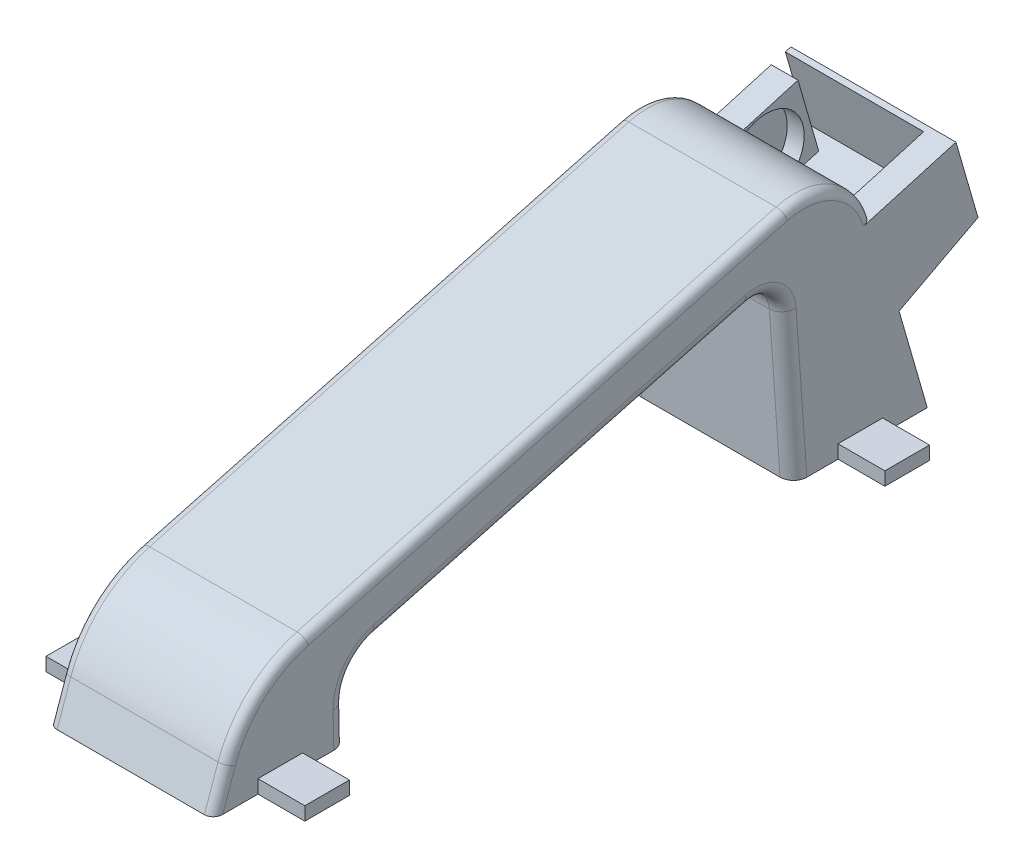
from build123d import *

# Parameters (mm, degrees)
BOSS_EXTRUDE2_DEPTH  = 18.5
SKETCH6_W            = 6
SKETCH6_H            = 24
BOSS_EXTRUDE3_DEPTH  = 15
SKETCH8_R            = 8.5
CUT_EXTRUDE1_DEPTH   = 3.8
FILLET1_R            = 2
CUT_EXTRUDE2_DEPTH   = 5.75
SKETCH13_R           = 1.5
BOSS_EXTRUDE4_DEPTH  = 2.8
CUT_EXTRUDE3_DEPTH   = 5
BOSS_EXTRUDE5_DEPTH  = 25
BOSS_EXTRUDE6_DEPTH  = 6
BOSS_EXTRUDE7_DEPTH  = 6
SKETCH21_W           = 10
SKETCH21_H           = 3
BOSS_EXTRUDE8_DEPTH  = 29
CUT_EXTRUDE4_DEPTH   = 40.35
FILLET3_R            = 3
BOSS_EXTRUDE9_DEPTH  = 0.72
BOSS_EXTRUDE10_DEPTH = 0.5


with BuildPart() as part:
    # Sketch3 → Boss-Extrude2 (new, symmetric)
    with BuildSketch(Plane(origin=(0, 0, 0), x_dir=(0, 0, -1), z_dir=(1, 0, 0))):
        with BuildLine():
            Line((70.215644723, -14.616921021), (-37.149843007, -43.385416754))
            ThreePointArc((-37.149843007, -43.385416754), (-48.03185115, -49.400738918), (-54.840494563, -59.804804318))
            Line((-54.840494563, -59.804804318), (-57.890133894, -68.528435815))
            Line((-57.890133894, -68.528435815), (-27.890133894, -68.528435815))
            Line((-27.890133894, -68.528435815), (-28.045315276, -60.640833764))
            ThreePointArc((-28.045315276, -60.640833764), (-26.192831463, -54.90703393), (-21.199231295, -51.534777392))
            Line((-21.199231295, -51.534777392), (62.07239701, -29.222211835))
            ThreePointArc((62.07239701, -29.222211835), (67.179013313, -30.144661991), (69.717111946, -34.670863455))
            Line((69.717111946, -34.670863455), (72.109866106, -68.528435815))
            Line((72.109866106, -68.528435815), (102.109866106, -68.528435815))
            Line((102.109866106, -68.528435815), (89.729215008, -25.63469666))
            ThreePointArc((89.729215008, -25.63469666), (82.223369532, -16.13917208), (70.215644723, -14.616921021))
        make_face()
    extrude(amount=BOSS_EXTRUDE2_DEPTH, both=True)

    # Sketch6 → Boss-Extrude3 (add)
    with BuildSketch(Plane(origin=(0, 21.935901884, -75.99865678), x_dir=(-1, 0, 0), z_dir=(0, 0.2773148488694124, -0.9607790977100487))):
        with Locations((15.5, -61.512524426)):
            Rectangle(SKETCH6_W, SKETCH6_H)
        with Locations((-15.5, -61.512524426)):
            Rectangle(SKETCH6_W, SKETCH6_H)
    extrude(amount=BOSS_EXTRUDE3_DEPTH)

    # Sketch8 → Cut-Extrude1 (cut, symmetric)
    with BuildSketch(Plane(origin=(-12.5, 0, 0), x_dir=(0, 0, -1), z_dir=(1, 0, 0))):
        with Locations(Location((97.028944136, -32.895134295, 0), (0, 0, 90))):
            Circle(SKETCH8_R)
    extrude(amount=CUT_EXTRUDE1_DEPTH, both=True, mode=Mode.SUBTRACT)

    # Fillet1
    fillet1_edges = [part.edges().sort_by_distance(p)[0] for p in [
        (-18.5, -64.166620067, 56.365314228),
        (-18.5, -49.400738918, 48.03185115),
        (-18.5, -29.001168888, -16.532900858),
        (-18.5, -16.13917208, -82.223369532),
        (18.5, -16.13917208, -82.223369532),
        (18.5, -29.001168888, -16.532900858),
        (18.5, -49.400738918, 48.03185115),
        (18.5, -64.166620067, 56.365314228),
    ]]
    fillet(fillet1_edges, radius=FILLET1_R)

    # Sketch11 → Cut-Extrude2 (cut, symmetric)
    with BuildSketch(Plane(origin=(0, -56.217610423, -16.226391868), x_dir=(-1, 0, 0), z_dir=(0, -0.9607790977100485, -0.27731484886941254))):
        Polygon((7.81656328, 78.53918235), (7.81656328, 78.58046301), (6.681356159, 78.58046301), (6.681356159, 79.101072204), (8.7, 79.101072204), (8.7, 78.53918235), align=None)
    extrude(amount=CUT_EXTRUDE2_DEPTH, both=True, mode=Mode.SUBTRACT)

    # Sketch13 → Boss-Extrude4 (add)
    with BuildSketch(Plane.ZY.offset(-12.5)):
        with Locations(Location((-97.028944136, -32.895134295, 0), (0, 0, 90))):
            Circle(SKETCH13_R)
    extrude(amount=BOSS_EXTRUDE4_DEPTH)

    # Sketch14 → Cut-Extrude3 (cut, symmetric)
    with BuildSketch(Plane(origin=(0, -56.217610423, -16.226391868), x_dir=(-1, 0, 0), z_dir=(0, -0.9607790977100485, -0.27731484886941254))):
        Polygon((5.308970226, 79.101072204), (5.308970226, 77.251148467), (4.283134363, 78.247993316), (-8.727974615, 78.247993316), (-9.605863403, 79.101072204), align=None)
    extrude(amount=CUT_EXTRUDE3_DEPTH, both=True, mode=Mode.SUBTRACT)

    # Sketch15 → Boss-Extrude5 (add)
    with BuildSketch(Plane(origin=(-12.5, 0, 0), x_dir=(0, 0, -1), z_dir=(1, 0, 0))):
        with BuildLine():
            Line((111.949490243, -36.654906984), (102.97963174, -39.243925585))
            ThreePointArc((102.97963174, -39.243925585), (99.232939792, -41.312986571), (94.953026489, -41.345483383))
            Line((94.953026489, -41.345483383), (94.312323076, -41.513234906))
            Line((94.312323076, -41.513234906), (95.789450175, -46.63085788))
            Line((95.789450175, -46.63085788), (113.479734367, -37.311821168))
            Line((113.479734367, -37.311821168), (108.542002376, -20.204660455))
            Line((108.542002376, -20.204660455), (107.304466525, -20.561857097))
            Line((107.304466525, -20.561857097), (111.949490243, -36.654906984))
        make_face()
    extrude(amount=BOSS_EXTRUDE5_DEPTH)

    # Sketch16 → Boss-Extrude6 (add)
    with BuildSketch(Plane(origin=(-12.5, 0, 0), x_dir=(0, 0, -1), z_dir=(1, 0, 0))):
        Polygon((108.785925192, -37.568023814), (109.341234091, -39.491935155), (113.479734367, -37.311821168), (108.542002376, -20.204660455), (107.304466525, -20.561857097), (111.949490243, -36.654906984), align=None)
    extrude(amount=-BOSS_EXTRUDE6_DEPTH)

    # Sketch17 → Boss-Extrude7 (add)
    with BuildSketch(Plane.ZY.offset(-12.5)):
        Polygon((-109.341234091, -39.491935155), (-104.140901474, -21.474973927), (-108.542002376, -20.204660455), (-113.479734367, -37.311821168), align=None)
    extrude(amount=-BOSS_EXTRUDE7_DEPTH)

    # Sketch21 → Boss-Extrude8 (add, symmetric)
    with BuildSketch(Plane(origin=(0, 0, 0), x_dir=(0, 0, -1), z_dir=(1, 0, 0))):
        with Locations((-42.890133894, -67.028435815)):
            Rectangle(SKETCH21_W, SKETCH21_H)
        with Locations((87.109866106, -67.028435815)):
            Rectangle(SKETCH21_W, SKETCH21_H)
    extrude(amount=BOSS_EXTRUDE8_DEPTH, both=True)

    # Sketch25 → Cut-Extrude4 (cut, symmetric)
    with BuildSketch(Plane.ZY.offset(-12.5)):
        Polygon((-96.384771381, -48.693395005), (-110.796457847, -44.533672272), (-109.341234091, -39.491935155), (-95.789450175, -46.63085788), align=None)
    extrude(amount=CUT_EXTRUDE4_DEPTH, both=True, mode=Mode.SUBTRACT)

    # Fillet3
    fillet3_edges = [part.edges().sort_by_distance(p)[0] for p in [
        (18.5, -54.90703393, 26.192831463),
        (-18.5, -51.599649635, -70.913489026),
        (-18.5, -30.144661991, -67.179013313),
        (-18.5, -40.378494613, -20.436582858),
        (-18.5, -54.90703393, 26.192831463),
        (-18.5, -64.58463479, 27.967724585),
        (18.5, -40.378494613, -20.436582858),
        (18.5, -30.144661991, -67.179013313),
        (18.5, -51.599649635, -70.913489026),
        (18.5, -64.58463479, 27.967724585),
    ]]
    fillet(fillet3_edges, radius=FILLET3_R)

    # Sketch24 → Boss-Extrude9 (add)
    with BuildSketch(Plane.ZY.offset(18.5)):
        Polygon((-95.625663774, -50.152284647), (-93.407144983, -42.466051865), (-92.446365885, -42.743366714), (-94.664884676, -50.429599496), align=None)
        Polygon((-90.42872978, -43.325727897), (-92.647248571, -51.011960679), (-91.686469473, -51.289275527), (-89.467950682, -43.603042746), align=None)
    extrude(amount=BOSS_EXTRUDE9_DEPTH)

    # Sketch26 → Boss-Extrude10 (add)
    with BuildSketch(Plane.ZY.offset(19.22)):
        Polygon((-93.407144983, -42.466051865), (-89.467950682, -43.603042746), (-91.686469473, -51.289275527), (-95.625663774, -50.152284647), align=None)
    extrude(amount=BOSS_EXTRUDE10_DEPTH)


solid = part.part
